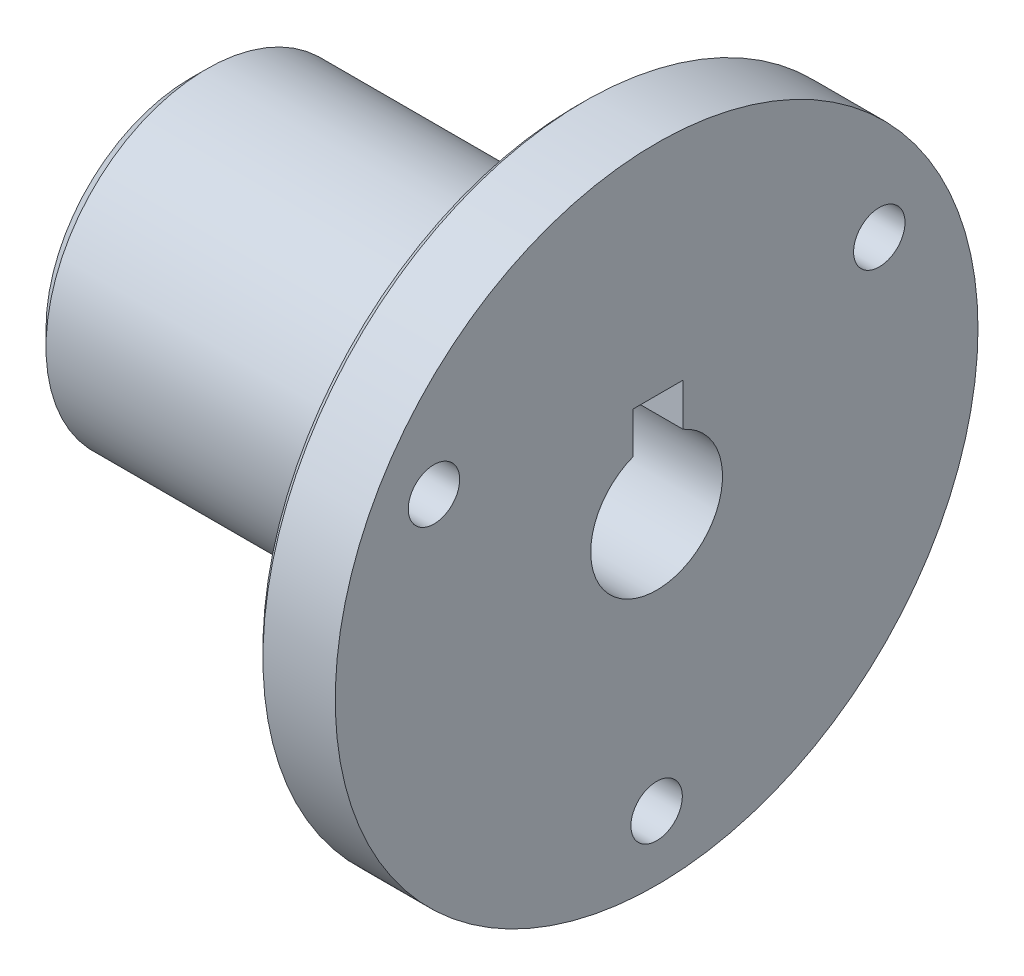
from build123d import *

# Parameters (mm, degrees)
SKETCH_1_R          = 10
EXTRUDE_1_DEPTH     = 24
SKETCH_2_R          = 20
SKETCH_2_R_2        = 1.6
EXTRUDE_2_DEPTH     = 5
CUT_EXTRUDE_1_REACH = 42.509
CHAMFER_1_SIZE      = 0.5
CHAMFER_2_SIZE      = 1
CHAMFER_3_SIZE      = 0.5
CHAMFER_4_SIZE      = 2


with BuildPart() as part:
    # 草图1 → 凸台-拉伸1 (new body)
    with BuildSketch(Plane(origin=(0, 0, 0), x_dir=(0, 0, -1), z_dir=(1, 0, 0))):
        Circle(SKETCH_1_R)
        with BuildLine():
            Line((-1.46, 6.008811728), (-1.46, 6.4))
            Line((-1.46, 6.4), (1.64, 6.4))
            Line((1.64, 6.4), (1.64, 6.008811728))
            Line((1.64, 6.008811728), (1.64, 3.75771207))
            ThreePointArc((1.64, 3.75771207), (-0.097219285, -4.098847205), (-1.46, 3.831240008))
            Line((-1.46, 3.831240008), (-1.46, 6.008811728))
        make_face(mode=Mode.SUBTRACT)
    extrude(amount=EXTRUDE_1_DEPTH)

    # 草图2 → 凸台-拉伸2 (add)
    with BuildSketch(Plane(origin=(24, 0, 0), x_dir=(0, 0, -1), z_dir=(1, 0, 0))):
        Circle(SKETCH_2_R)
        with Locations((-13.856406461, 8)):
            Circle(SKETCH_2_R_2, mode=Mode.SUBTRACT)
        with Locations((13.856406461, 8)):
            Circle(SKETCH_2_R_2, mode=Mode.SUBTRACT)
        with Locations((0, -16)):
            Circle(SKETCH_2_R_2, mode=Mode.SUBTRACT)
    extrude(amount=EXTRUDE_2_DEPTH)

    # 草图5 → 切除-拉伸1 (cut, up to next)
    with BuildSketch(Plane(origin=(29, 0, 0), x_dir=(0, 0, -1), z_dir=(1, 0, 0)), mode=Mode.PRIVATE) as cut_extrude_1_sk1:
        with BuildLine():
            Line((-1.46, 6.4), (-1.46, 3.831240008))
            ThreePointArc((-1.46, 3.831240008), (-0.097219285, -4.098847205), (1.64, 3.75771207))
            Line((1.64, 3.75771207), (1.64, 6.4))
            Line((1.64, 6.4), (-1.46, 6.4))
        make_face()
    cut_extrude_1_tool1 = extrude(cut_extrude_1_sk1.sketch, amount=-CUT_EXTRUDE_1_REACH, mode=Mode.PRIVATE) & part.part
    add(cut_extrude_1_tool1.solids().sort_by_distance((29, 0.642064, -0.012064))[0], mode=Mode.SUBTRACT)

    # 倒角1
    chamfer_1_edges = [part.edges().sort_by_distance(p)[0] for p in [
        (0, -4.098847205, 0.097219285),
    ]]
    chamfer(chamfer_1_edges, length=CHAMFER_1_SIZE)

    # 倒角2
    chamfer_2_edges = [part.edges().sort_by_distance(p)[0] for p in [
        (0, 0, 10),
    ]]
    chamfer(chamfer_2_edges, length=CHAMFER_2_SIZE)

    # 倒角3
    chamfer_3_edges = [part.edges().sort_by_distance(p)[0] for p in [
        (24, 0, 20),
    ]]
    chamfer(chamfer_3_edges, length=CHAMFER_3_SIZE)

    # 倒角4
    chamfer_4_edges = [part.edges().sort_by_distance(p)[0] for p in [
        (24, 0, 10),
    ]]
    chamfer(chamfer_4_edges, length=CHAMFER_4_SIZE)


solid = part.part
